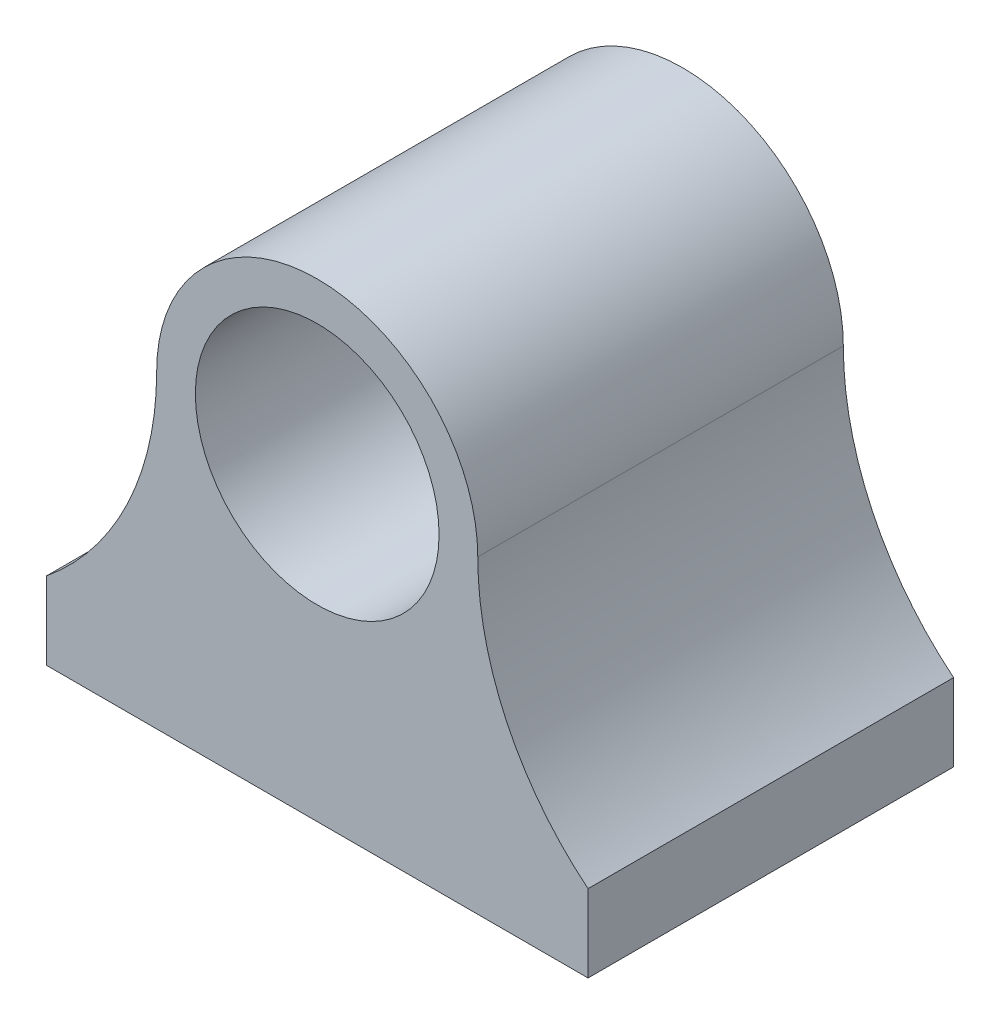
from build123d import *

# Parameters (mm, degrees)
SKETCH1_R           = 10
BOSS_EXTRUDE1_DEPTH = 30


with BuildPart() as part:
    # Sketch1 → Boss-Extrude1 (new body)
    with BuildSketch(Plane.XY):
        with BuildLine():
            ThreePointArc((13.175, 0), (15.552506488, -10.54520033), (22.225, -19.05))
            Line((22.225, -19.05), (22.225, -25.4))
            Line((22.225, -25.4), (-22.225, -25.4))
            Line((-22.225, -25.4), (-22.225, -19.05))
            ThreePointArc((-22.225, -19.05), (-15.552506488, -10.54520033), (-13.175, 0))
            ThreePointArc((-13.175, 0), (0, 13.175), (13.175, 0))
        make_face()
        Circle(SKETCH1_R, mode=Mode.SUBTRACT)
    extrude(amount=BOSS_EXTRUDE1_DEPTH)


solid = part.part
